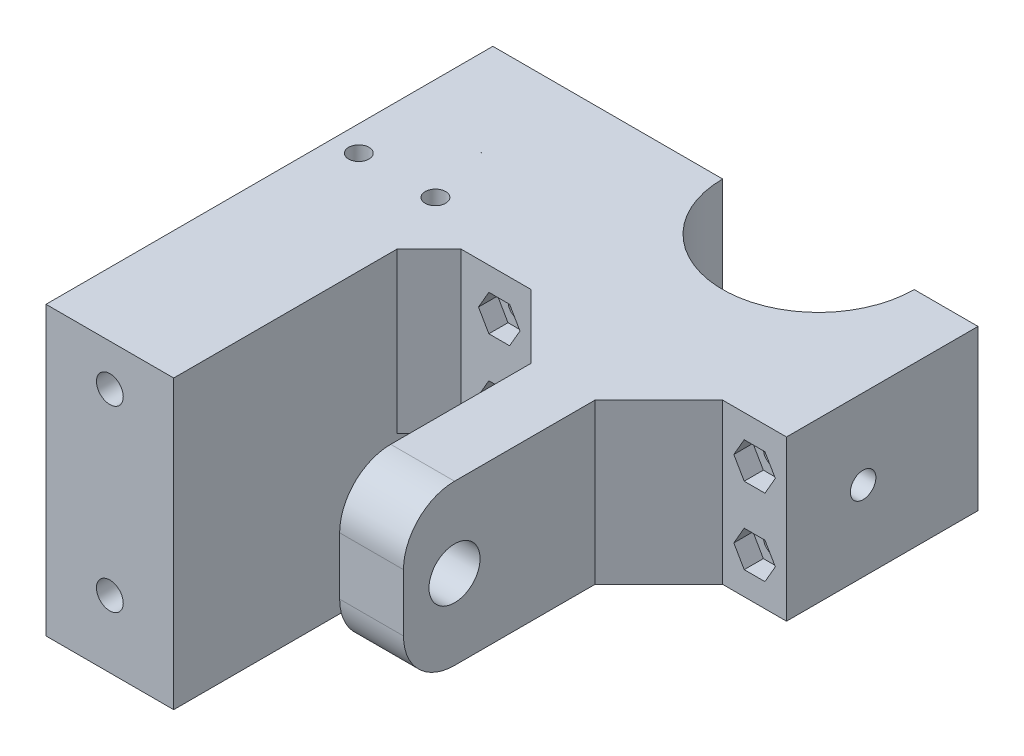
from build123d import *

# Parameters (mm, degrees)
BOSS_EXTRUDE1_DEPTH = 25
SKETCH2_R           = 4
CUT_EXTRUDE1_DEPTH  = 88.229582138
SKETCH3_R           = 1.6
CUT_EXTRUDE2_DEPTH  = 79.755553628
CUT_EXTRUDE3_DEPTH  = 3
FILLET2_R           = 8
CHAMFER2_SIZE       = 10
SKETCH5_W           = 30
SKETCH5_H           = 25
BOSS_EXTRUDE2_DEPTH = 26
SKETCH6_W           = 20.004484435
SKETCH6_H           = 25
BOSS_EXTRUDE3_DEPTH = 40
SKETCH7_W           = 10.4
SKETCH7_H           = 20.4
CUT_EXTRUDE4_DEPTH  = 23
SKETCH9_W           = 20.004484435
SKETCH9_H           = 40
SKETCH9_W_2         = 10.4
SKETCH9_H_2         = 20.4
BOSS_EXTRUDE4_DEPTH = 20
SKETCH10_R          = 2.1
CUT_EXTRUDE6_DEPTH  = 90.566948883
CHAMFER5_SIZE       = 5
SKETCH11_R          = 2
CUT_EXTRUDE7_DEPTH  = 112.736296699
SKETCH12_W          = 20.004484435
SKETCH12_H          = 20
SKETCH12_R          = 2.1
BOSS_EXTRUDE5_DEPTH = 30
SKETCH13_R          = 1.6
CUT_EXTRUDE8_DEPTH  = 103.986592973


with BuildPart() as part:
    # Sketch1 → Boss-Extrude1 (new body)
    with BuildSketch(Plane(origin=(0, 0, 0), x_dir=(1, 0, 0), z_dir=(0, 1, 0))):
        with BuildLine():
            Line((-13.972375691, -8), (-23.972375691, -8))
            Line((-23.972375691, -8), (-23.972375691, -38))
            Line((-23.972375691, -38), (-3.972375691, -38))
            Line((-3.972375691, -38), (-3.972375691, -78))
            Line((-3.972375691, -78), (6.027624309, -78))
            Line((6.027624309, -78), (6.027624309, -38))
            Line((6.027624309, -38), (26.027624309, -38))
            Line((26.027624309, -38), (26.027624309, -8))
            Line((26.027624309, -8), (16.027624309, -8))
            ThreePointArc((16.027624309, -8), (1.027624309, -23), (-13.972375691, -8))
        make_face()
    extrude(amount=BOSS_EXTRUDE1_DEPTH)

    # Sketch2 → Cut-Extrude1 (cut, through all)
    with BuildSketch(Plane.ZY.offset(3.972375691)):
        with Locations((70, 12.5)):
            Circle(SKETCH2_R)
    extrude(amount=-CUT_EXTRUDE1_DEPTH, mode=Mode.SUBTRACT)

    # Sketch3 → Cut-Extrude2 (cut, through all)
    with BuildSketch(Plane(origin=(0, 0, 8), x_dir=(-1, 0, 0), z_dir=(0, 0, -1))):
        with Locations((-21.027624309, 6.5)):
            Circle(SKETCH3_R)
        with Locations((-21.027624309, 18.5)):
            Circle(SKETCH3_R)
        with Locations((18.972375691, 6.5)):
            Circle(SKETCH3_R)
        with Locations((18.972375691, 18.5)):
            Circle(SKETCH3_R)
    extrude(amount=-CUT_EXTRUDE2_DEPTH, mode=Mode.SUBTRACT)

    # Sketch4 → Cut-Extrude3 (cut)
    with BuildSketch(Plane.XY.offset(38)):
        Polygon((24.277624309, 18.5), (22.652624309, 21.314582562), (19.402624309, 21.314582562), (17.777624309, 18.5), (19.402624309, 15.685417438), (22.652624309, 15.685417438), align=None)
        Polygon((24.277624309, 6.5), (22.652624309, 9.314582562), (19.402624309, 9.314582562), (17.777624309, 6.5), (19.402624309, 3.685417438), (22.652624309, 3.685417438), align=None)
        Polygon((-15.722375691, 18.5), (-17.347375691, 21.314582562), (-20.597375691, 21.314582562), (-22.222375691, 18.5), (-20.597375691, 15.685417438), (-17.347375691, 15.685417438), align=None)
        Polygon((-15.722375691, 6.5), (-17.347375691, 9.314582562), (-20.597375691, 9.314582562), (-22.222375691, 6.5), (-20.597375691, 3.685417438), (-17.347375691, 3.685417438), align=None)
    extrude(amount=-CUT_EXTRUDE3_DEPTH, mode=Mode.SUBTRACT)

    # Fillet2
    fillet2_edges = [part.edges().sort_by_distance(p)[0] for p in [
        (1.027624309, 0, 78),
        (1.027624309, 25, 78),
    ]]
    fillet(fillet2_edges, radius=FILLET2_R)

    # Chamfer2
    chamfer2_edges = [part.edges().sort_by_distance(p)[0] for p in [
        (6.027624309, 12.5, 38),
        (-3.972375691, 12.5, 38),
    ]]
    chamfer(chamfer2_edges, length=CHAMFER2_SIZE)

    # Sketch5 → Boss-Extrude2 (add)
    with BuildSketch(Plane.ZY.offset(23.972375691)):
        with Locations((23, 12.5)):
            Rectangle(SKETCH5_W, SKETCH5_H)
    extrude(amount=BOSS_EXTRUDE2_DEPTH)

    # Sketch6 → Boss-Extrude3 (add)
    with BuildSketch(Plane.XY.offset(38)):
        with Locations((-39.970133473, 12.5)):
            Rectangle(SKETCH6_W, SKETCH6_H)
    extrude(amount=BOSS_EXTRUDE3_DEPTH)

    # Sketch7 → Cut-Extrude4 (cut)
    with BuildSketch(Plane.XZ):
        with Locations((-39.970133474, 58)):
            Rectangle(SKETCH7_W, SKETCH7_H)
    extrude(amount=-CUT_EXTRUDE4_DEPTH, mode=Mode.SUBTRACT)

    # Sketch9 → Boss-Extrude4 (add)
    with BuildSketch(Plane.XZ):
        with Locations((-39.970133473, 58)):
            Rectangle(SKETCH9_W, SKETCH9_H)
        with Locations((-39.970133474, 58)):
            Rectangle(SKETCH9_W_2, SKETCH9_H_2, mode=Mode.SUBTRACT)
    extrude(amount=BOSS_EXTRUDE4_DEPTH)

    # Sketch10 → Cut-Extrude6 (cut, through all)
    with BuildSketch(Plane.XY.offset(78)):
        with Locations((-39.970133474, -9.5)):
            Circle(SKETCH10_R)
        with Locations((-39.970133474, 18.5)):
            Circle(SKETCH10_R)
    extrude(amount=-CUT_EXTRUDE6_DEPTH, mode=Mode.SUBTRACT)

    # Chamfer5
    chamfer5_edges = [part.edges().sort_by_distance(p)[0] for p in [
        (-29.967891256, 12.5, 38),
    ]]
    chamfer(chamfer5_edges, length=CHAMFER5_SIZE)

    # Sketch11 → Cut-Extrude7 (cut, through all)
    with BuildSketch(Plane(origin=(26.027624309, 0, 0), x_dir=(0, 0, -1), z_dir=(1, 0, 0))):
        with Locations((-26, 12.5)):
            Circle(SKETCH11_R)
    extrude(amount=-CUT_EXTRUDE7_DEPTH, mode=Mode.SUBTRACT)

    # Sketch12 → Boss-Extrude5 (add)
    with BuildSketch(Plane(origin=(0, 0, 38), x_dir=(-1, 0, 0), z_dir=(0, 0, -1))):
        with Locations((39.970133473, -10)):
            Rectangle(SKETCH12_W, SKETCH12_H)
        with Locations(Location((39.970133474, -9.5, 0), (0, 0, 180))):
            Circle(SKETCH12_R, mode=Mode.SUBTRACT)
    extrude(amount=BOSS_EXTRUDE5_DEPTH)

    # Sketch13 → Cut-Extrude8 (cut, through all)
    with BuildSketch(Plane.XZ.offset(20)):
        with Locations(Location((-33.970133474, 33, 0), (0, 0, 270))):
            Circle(SKETCH13_R)
        with Locations(Location((-45.970133474, 33, 0), (0, 0, 270))):
            Circle(SKETCH13_R)
    extrude(amount=-CUT_EXTRUDE8_DEPTH, mode=Mode.SUBTRACT)


solid = part.part
